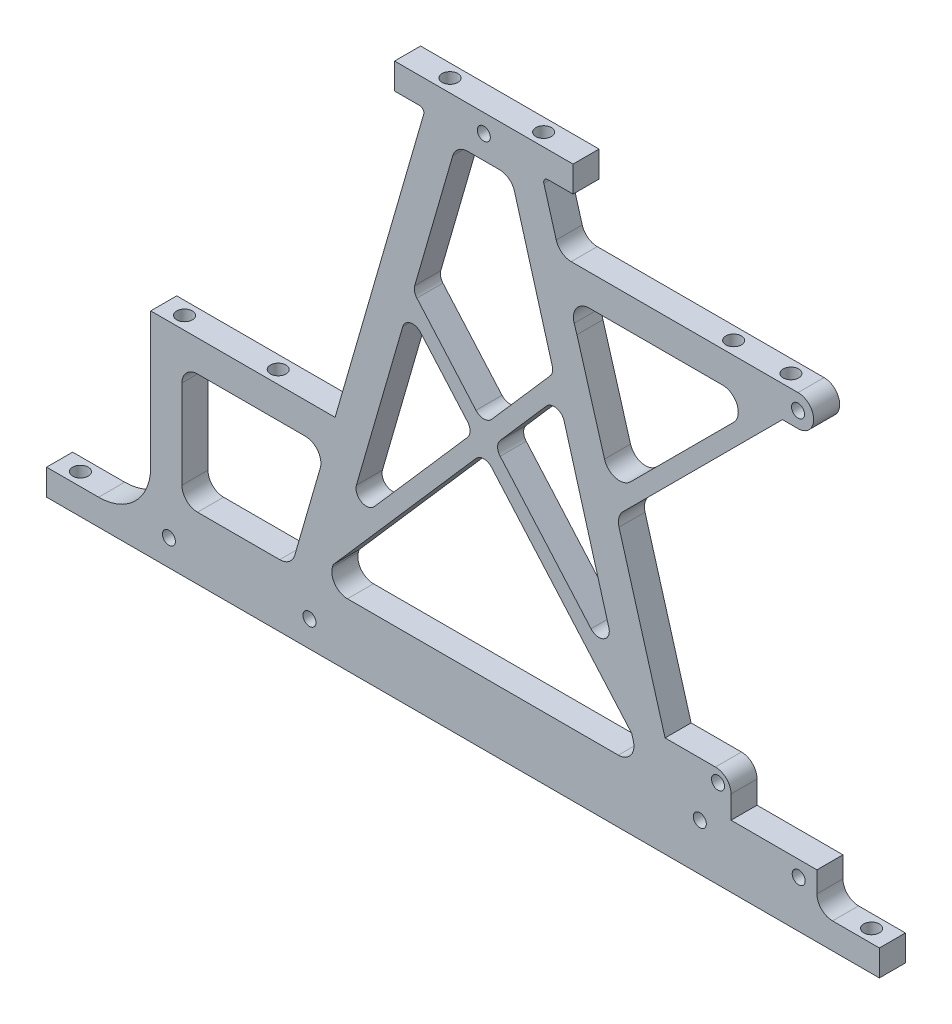
from build123d import *

# Parameters (mm, degrees)
SKETCH1_R           = 1.25
BOSS_EXTRUDE1_DEPTH = 5
SKETCH2_R           = 1.25
CUT_EXTRUDE1_DEPTH  = 15
SKETCH3_R           = 1.5
CUT_EXTRUDE2_DEPTH  = 115
SKETCH4_R           = 1.5
CUT_EXTRUDE3_DEPTH  = 25
SKETCH5_R           = 1.5
CUT_EXTRUDE4_DEPTH  = 115
SKETCH6_R           = 1.5
CUT_EXTRUDE5_DEPTH  = 76
SKETCH8_R           = 1.5
CUT_EXTRUDE6_DEPTH  = 11


with BuildPart() as part:
    # Sketch1 → Boss-Extrude1 (new body)
    with BuildSketch(Plane.XY):
        with BuildLine():
            Line((-84, 0), (0, 0))
            Line((0, 0), (76, 0))
            Line((76, 0), (76, 5))
            Line((76, 5), (67, 5))
            ThreePointArc((67, 5), (64.87868, 5.87868), (64, 8))
            Line((64, 8), (64, 12))
            Line((64, 12), (47.5, 12))
            Line((47.5, 12), (47.5, 16.356013))
            ThreePointArc((47.5, 16.356013), (46.62132, 18.477334), (44.5, 19.356013))
            Line((44.5, 19.356013), (42.584405, 19.356013))
            Line((42.584405, 19.356013), (34.826345, 19.356013))
            Line((34.826345, 19.356013), (25.975089, 49.998488))
            ThreePointArc((25.975089, 49.998488), (25.952083, 51.579328), (26.735936, 52.952339))
            Line((26.735936, 52.952339), (57.374113, 83.590516))
            Line((57.374113, 83.590516), (60.374113, 83.590516))
            ThreePointArc((60.374113, 83.590516), (63.374113, 86.590516), (60.374113, 89.590516))
            Line((60.374113, 89.590516), (16.794783, 89.590516))
            ThreePointArc((16.794783, 89.590516), (14.991674, 90.192851), (13.912615, 91.757985))
            Line((13.912615, 91.757985), (11.538218, 99.977992))
            ThreePointArc((11.538218, 99.977992), (11.667419, 100.680829), (12.306797, 101))
            Line((12.306797, 101), (17.144141, 101))
            Line((17.144141, 101), (17.144141, 106))
            Line((17.144141, 106), (-17.144141, 106))
            Line((-17.144141, 106), (-17.144141, 101))
            Line((-17.144141, 101), (-12.306797, 101))
            ThreePointArc((-12.306797, 101), (-11.667419, 100.680829), (-11.538218, 99.977992))
            Line((-11.538218, 99.977992), (-28.574354, 41))
            Line((-28.574354, 41), (-64, 41))
            Line((-64, 41), (-64, 15))
            ThreePointArc((-64, 15), (-66.928932, 7.928932), (-74, 5))
            Line((-74, 5), (-84, 5))
            Line((-84, 5), (-84, 0))
        make_face()
        with Locations((0, 102.5)):
            Circle(SKETCH1_R, mode=Mode.SUBTRACT)
        with Locations((45, 17)):
            Circle(SKETCH1_R, mode=Mode.SUBTRACT)
        with Locations((41.5, 9)):
            Circle(SKETCH1_R, mode=Mode.SUBTRACT)
        with Locations((60.5, 9)):
            Circle(SKETCH1_R, mode=Mode.SUBTRACT)
        with Locations((60.374113, 86.590516)):
            Circle(SKETCH1_R, mode=Mode.SUBTRACT)
        with BuildLine():
            Line((-55, 35), (-34.296706, 35))
            ThreePointArc((-34.296706, 35), (-31.899041, 33.803109), (-31.414538, 31.167469))
            Line((-31.414538, 31.167469), (-36.325087, 14.167469))
            ThreePointArc((-36.325087, 14.167469), (-37.404145, 12.602335), (-39.207254, 12))
            Line((-39.207254, 12), (-55, 12))
            ThreePointArc((-55, 12), (-57.12132, 12.87868), (-58, 15))
            Line((-58, 15), (-58, 32))
            ThreePointArc((-58, 32), (-57.12132, 34.12132), (-55, 35))
        make_face(mode=Mode.SUBTRACT)
        with BuildLine():
            Line((-26.196215, 12), (25.838936, 12))
            ThreePointArc((25.838936, 12), (28.233641, 13.192962), (28.723818, 15.823077))
            Line((28.723818, 15.823077), (28.41252, 16.914174))
            Line((28.41252, 16.914174), (1.505858, 47.697877))
            ThreePointArc((1.505858, 47.697877), (0, 48.381673), (-1.505858, 47.697877))
            Line((-1.505858, 47.697877), (-28.940396, 16.310236))
            Line((-28.940396, 16.310236), (-29.078383, 15.832531))
            ThreePointArc((-29.078383, 15.832531), (-28.59388, 13.196891), (-26.196215, 12))
        make_face(mode=Mode.SUBTRACT)
        with BuildLine():
            Line((15.437427, 62.39185), (24.030004, 32.274885))
            ThreePointArc((24.030004, 32.274885), (23.062279, 29.969192), (20.600891, 30.409964))
            Line((20.600891, 30.409964), (3.142654, 50.383797))
            ThreePointArc((3.142654, 50.383797), (2.648512, 51.7), (3.142654, 53.016203))
            Line((3.142654, 53.016203), (12.008314, 63.159336))
            ThreePointArc((12.008314, 63.159336), (13.950994, 63.794846), (15.437427, 62.39185))
        make_face(mode=Mode.SUBTRACT)
        with BuildLine():
            Line((-3.142654, 53.016203), (-12.152635, 63.324452))
            ThreePointArc((-12.152635, 63.324452), (-14.092115, 63.960676), (-15.579938, 62.563269))
            Line((-15.579938, 62.563269), (-24.47463, 31.770424))
            ThreePointArc((-24.47463, 31.770424), (-23.511594, 29.459997), (-21.047327, 29.8992))
            Line((-21.047327, 29.8992), (-3.142654, 50.383797))
            ThreePointArc((-3.142654, 50.383797), (-2.648512, 51.7), (-3.142654, 53.016203))
        make_face(mode=Mode.SUBTRACT)
        with BuildLine():
            Line((-13.270648, 70.557882), (-5.969919, 95.832531))
            ThreePointArc((-5.969919, 95.832531), (-4.89086, 97.397665), (-3.087751, 98))
            Line((-3.087751, 98), (3.014386, 98))
            ThreePointArc((3.014386, 98), (4.821424, 97.394706), (5.899268, 95.823077))
            Line((5.899268, 95.823077), (13.149527, 70.410935))
            ThreePointArc((13.149527, 70.410935), (13.177986, 69.425395), (12.73213, 68.546014))
            Line((12.73213, 68.546014), (1.505858, 55.702123))
            ThreePointArc((1.505858, 55.702123), (0, 55.018327), (-1.505858, 55.702123))
            Line((-1.505858, 55.702123), (-12.855061, 68.686658))
            ThreePointArc((-12.855061, 68.686658), (-13.30163, 69.569239), (-13.270648, 70.557882))
        make_face(mode=Mode.SUBTRACT)
        with BuildLine():
            Line((17.892665, 77.979312), (17.361692, 79.621616))
            ThreePointArc((17.361692, 79.621616), (17.795471, 82.341157), (20.249686, 83.590516))
            Line((20.249686, 83.590516), (45.888831, 83.590516))
            ThreePointArc((45.888831, 83.590516), (48.66047, 81.738566), (48.010152, 78.469195))
            Line((48.010152, 78.469195), (28.190525, 58.649569))
            ThreePointArc((28.190525, 58.649569), (25.327066, 57.864134), (23.190599, 59.926126))
            Line((23.190599, 59.926126), (17.892665, 77.979312))
        make_face(mode=Mode.SUBTRACT)
    extrude(amount=BOSS_EXTRUDE1_DEPTH)

    # Sketch2 → Cut-Extrude1 (cut)
    with BuildSketch(Plane.XY.offset(5)):
        with Locations((-33.5, 5)):
            Circle(SKETCH2_R)
        with Locations((-60.5, 5)):
            Circle(SKETCH2_R)
    extrude(amount=-CUT_EXTRUDE1_DEPTH, mode=Mode.SUBTRACT)

    # Sketch3 → Cut-Extrude2 (cut)
    with BuildSketch(Plane(origin=(0, 106, 0), x_dir=(1, 0, 0), z_dir=(0, 1, 0))):
        with Locations(Location((-80, -2.5, 0), (0, 0, 270))):
            Circle(SKETCH3_R)
    extrude(amount=-CUT_EXTRUDE2_DEPTH, mode=Mode.SUBTRACT)

    # Sketch4 → Cut-Extrude3 (cut)
    with BuildSketch(Plane(origin=(0, 106, 0), x_dir=(1, 0, 0), z_dir=(0, 1, 0))):
        with Locations(Location((45.5, -2.5, 0), (0, 0, 285.023837))):
            Circle(SKETCH4_R)
        with Locations(Location((56.5, -2.5, 0), (0, 0, 305.643618))):
            Circle(SKETCH4_R)
    extrude(amount=-CUT_EXTRUDE3_DEPTH, mode=Mode.SUBTRACT)

    # Sketch5 → Cut-Extrude4 (cut)
    with BuildSketch(Plane(origin=(0, 106, 0), x_dir=(1, 0, 0), z_dir=(0, 1, 0))):
        with Locations(Location((72, -2.5, 0), (0, 0, 270))):
            Circle(SKETCH5_R)
    extrude(amount=-CUT_EXTRUDE4_DEPTH, mode=Mode.SUBTRACT)

    # Sketch6 → Cut-Extrude5 (cut)
    with BuildSketch(Plane(origin=(0, 106, 0), x_dir=(1, 0, 0), z_dir=(0, 1, 0))):
        with Locations(Location((-42, -2.5, 0), (0, 0, 180))):
            Circle(SKETCH6_R)
        with Locations(Location((-60, -2.5, 0), (0, 0, 270))):
            Circle(SKETCH6_R)
    extrude(amount=-CUT_EXTRUDE5_DEPTH, mode=Mode.SUBTRACT)

    # Sketch8 → Cut-Extrude6 (cut)
    with BuildSketch(Plane(origin=(0, 106, 0), x_dir=(1, 0, 0), z_dir=(0, 1, 0))):
        with Locations(Location((-9, -2.5, 0), (0, 0, 270))):
            Circle(SKETCH8_R)
        with Locations(Location((9, -2.5, 0), (0, 0, 270))):
            Circle(SKETCH8_R)
    extrude(amount=-CUT_EXTRUDE6_DEPTH, mode=Mode.SUBTRACT)


solid = part.part
